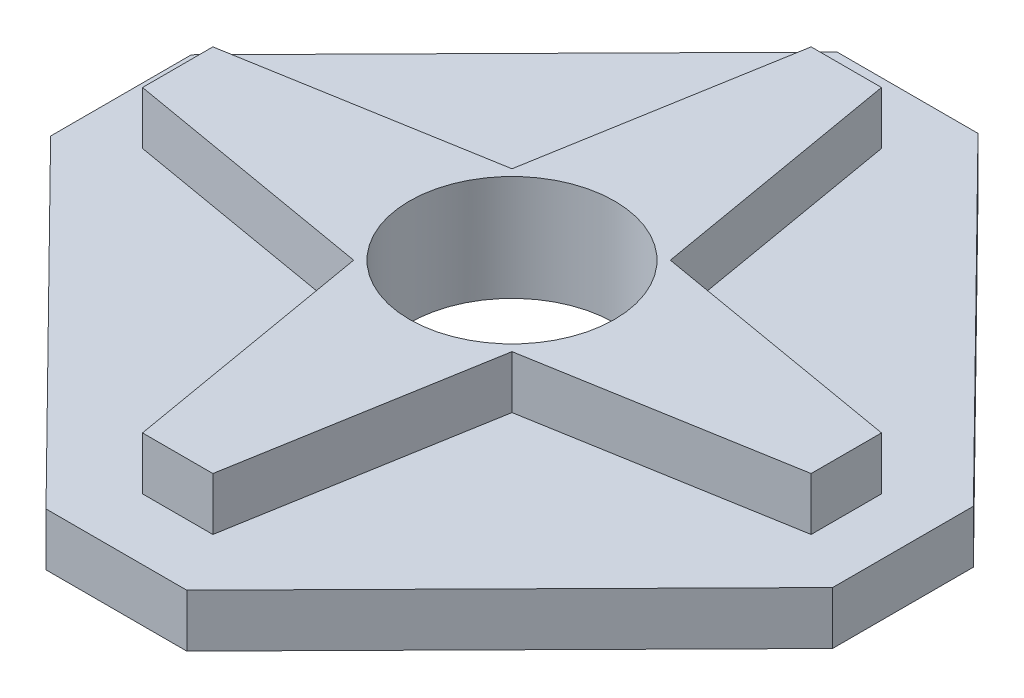
from build123d import *

# Parameters (mm, degrees)
BOSS_EXTRUDE1_DEPTH = 3
BOSS_EXTRUDE2_DEPTH = 3
SKETCH4_R           = 5.829154491
CUT_EXTRUDE3_DEPTH  = 10


with BuildPart() as part:
    # Sketch1 → Boss-Extrude1 (new body)
    with BuildSketch(Plane(origin=(0, 0, 0), x_dir=(1, 0, 0), z_dir=(0, 1, 0))):
        Polygon((-2, 19), (2, 19), (4.5, 4.5), (19, 2), (19, -2), (4.5, -4.5), (2, -19), (-2, -19), (-4.5, -4.5), (-19, -2), (-19, 2), (-4.5, 4.5), align=None)
    extrude(amount=BOSS_EXTRUDE1_DEPTH)

    # Sketch2 → Boss-Extrude2 (add)
    with BuildSketch(Plane(origin=(0, 0, 0), x_dir=(1, 0, 0), z_dir=(0, 1, 0))):
        Polygon((4, 22.483937469), (-4, 22.483937469), (-22.222005883, 4), (-22.222005883, -4), (-4, -22.483937469), (4, -22.483937469), (22.222005883, -4), (22.222005883, 4), align=None)
    extrude(amount=-BOSS_EXTRUDE2_DEPTH)

    # Sketch4 → Cut-Extrude3 (cut, symmetric)
    with BuildSketch(Plane(origin=(0, 0, 0), x_dir=(1, 0, 0), z_dir=(0, 1, 0))):
        with Locations(Location((0, 0, 0), (0, 0, 90))):
            Circle(SKETCH4_R)
    extrude(amount=CUT_EXTRUDE3_DEPTH, both=True, mode=Mode.SUBTRACT)


solid = part.part
